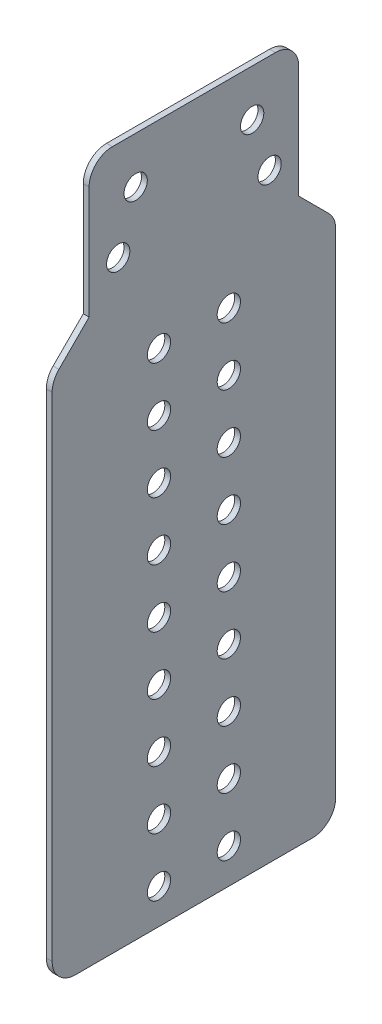
from build123d import *

# Parameters (mm, degrees)
SKETCH1_W                = 36
SKETCH1_H                = 120
BOSS_EXTRUDE1_DEPTH      = 1
F_4_0_4_DIAMETER_HOLE2_D = 4
F_4_0_4_DIAMETER_HOLE3_D = 4
F_4_0_4_DIAMETER_HOLE1_D = 4
BOSS_EXTRUDE2_DEPTH      = 1
FILLET1_R                = 4


with BuildPart() as part:
    # Sketch1 → Boss-Extrude1 (new body)
    with BuildSketch(Plane(origin=(0, 0, 0), x_dir=(0, 0, -1), z_dir=(1, 0, 0))):
        with Locations((0, -60)):
            Rectangle(SKETCH1_W, SKETCH1_H)
    extrude(amount=BOSS_EXTRUDE1_DEPTH)

    # Ø4.0 (4) Diameter Hole2 (through all)
    with Locations(Plane.ZY):
        with Locations((-10, -8), (10, -8)):
            Hole(F_4_0_4_DIAMETER_HOLE2_D / 2)

    # Ø4.0 (4) Diameter Hole3 (through all)
    with Locations(Plane.ZY):
        with Locations((-13, -17), (13, -17)):
            Hole(F_4_0_4_DIAMETER_HOLE3_D / 2)

    # Ø4.0 (4) Diameter Hole1 (through all)
    with Locations(Plane(origin=(1, 0, 0), x_dir=(0, 0, -1), z_dir=(1, 0, 0))):
        with Locations((6, -114), (-6, -114), (6, -104), (-6, -104), (6, -94), (-6, -94), (6, -84), (-6, -84), (6, -74), (-6, -74), (6, -64), (-6, -64), (6, -54), (-6, -54), (6, -44), (-6, -44), (6, -34), (-6, -34)):
            Hole(F_4_0_4_DIAMETER_HOLE1_D / 2)

    # Sketch9 → Boss-Extrude2 (add)
    with BuildSketch(Plane.ZY):
        with BuildLine():
            Line((18, -23.35), (23.178427125, -28.528427125))
            ThreePointArc((23.178427125, -28.528427125), (24.04551813, -29.82612052), (24.35, -31.356854249))
            Line((24.35, -31.356854249), (24.35, -116))
            ThreePointArc((24.35, -116), (23.178427125, -118.828427125), (20.35, -120))
            Line((20.35, -120), (18, -120))
            Line((18, -120), (18, -23.35))
        make_face()
        with BuildLine():
            Line((-18, -23.35), (-23.178427125, -28.528427125))
            ThreePointArc((-23.178427125, -28.528427125), (-24.04551813, -29.82612052), (-24.35, -31.356854249))
            Line((-24.35, -31.356854249), (-24.35, -116))
            ThreePointArc((-24.35, -116), (-23.178427125, -118.828427125), (-20.35, -120))
            Line((-20.35, -120), (-18, -120))
            Line((-18, -120), (-18, -23.35))
        make_face()
    extrude(amount=-BOSS_EXTRUDE2_DEPTH)

    # Fillet1
    fillet1_edges = [part.edges().sort_by_distance(p)[0] for p in [
        (0.5, 0, 18),
        (0.5, 0, -18),
    ]]
    fillet(fillet1_edges, radius=FILLET1_R)


solid = part.part
